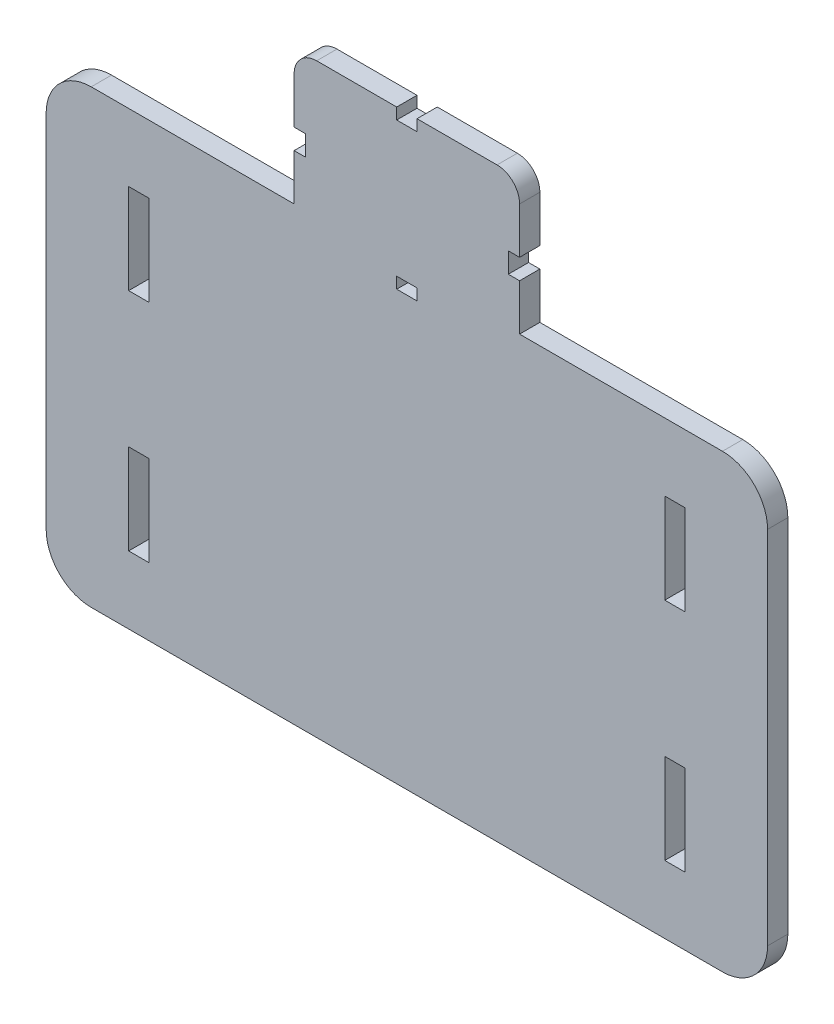
from build123d import *

# Parameters (mm, degrees)
SKETCH1_W           = 160
SKETCH1_H           = 100
BOSS_EXTRUDE1_DEPTH = 4.5
FILLET1_R           = 10
SKETCH2_W           = 4.5
SKETCH2_H           = 20
CUT_EXTRUDE1_DEPTH  = 5
SKETCH3_W           = 50
SKETCH3_H           = 30
BOSS_EXTRUDE2_DEPTH = 4.5
FILLET2_R           = 5
SKETCH4_W           = 4.5
SKETCH4_H           = 2.5
SKETCH4_W_2         = 2.5
SKETCH4_H_2         = 4.5
CUT_EXTRUDE2_DEPTH  = 4.5


with BuildPart() as part:
    # Sketch1 → Boss-Extrude1 (new body)
    with BuildSketch(Plane.XY):
        Rectangle(SKETCH1_W, SKETCH1_H)
    extrude(amount=BOSS_EXTRUDE1_DEPTH)

    # Fillet1
    fillet1_edges = [part.edges().sort_by_distance(p)[0] for p in [
        (80, -50, 2.25),
        (-80, -50, 2.25),
        (-80, 50, 2.25),
        (80, 50, 2.25),
    ]]
    fillet(fillet1_edges, radius=FILLET1_R)

    # Sketch2 → Cut-Extrude1 (cut)
    with BuildSketch(Plane.XY.offset(4.5)):
        with Locations((-59.45, 25)):
            Rectangle(SKETCH2_W, SKETCH2_H)
        with Locations((-59.45, -25)):
            Rectangle(SKETCH2_W, SKETCH2_H)
        with Locations((59.45, -25)):
            Rectangle(SKETCH2_W, SKETCH2_H)
        with Locations((59.45, 25)):
            Rectangle(SKETCH2_W, SKETCH2_H)
    extrude(amount=-CUT_EXTRUDE1_DEPTH, mode=Mode.SUBTRACT)

    # Sketch3 → Boss-Extrude2 (add)
    with BuildSketch(Plane.XY.offset(4.5)):
        with Locations((0, 65)):
            Rectangle(SKETCH3_W, SKETCH3_H)
    extrude(amount=-BOSS_EXTRUDE2_DEPTH)

    # Fillet2
    fillet2_edges = [part.edges().sort_by_distance(p)[0] for p in [
        (-25, 80, 2.25),
        (25, 80, 2.25),
    ]]
    fillet(fillet2_edges, radius=FILLET2_R)

    # Sketch4 → Cut-Extrude2 (cut)
    with BuildSketch(Plane.XY.offset(4.5)):
        with Locations((0, 78.75)):
            Rectangle(SKETCH4_W, SKETCH4_H)
        with Locations((26.25, 62.5)):
            Rectangle(SKETCH4_W_2, SKETCH4_H_2)
        with Locations((23.75, 62.5)):
            Rectangle(SKETCH4_W_2, SKETCH4_H_2)
        with Locations((-23.75, 62.5)):
            Rectangle(SKETCH4_W_2, SKETCH4_H_2)
        with Locations((0, 46.25)):
            Rectangle(SKETCH4_W, SKETCH4_H)
    extrude(amount=-CUT_EXTRUDE2_DEPTH, mode=Mode.SUBTRACT)


solid = part.part
